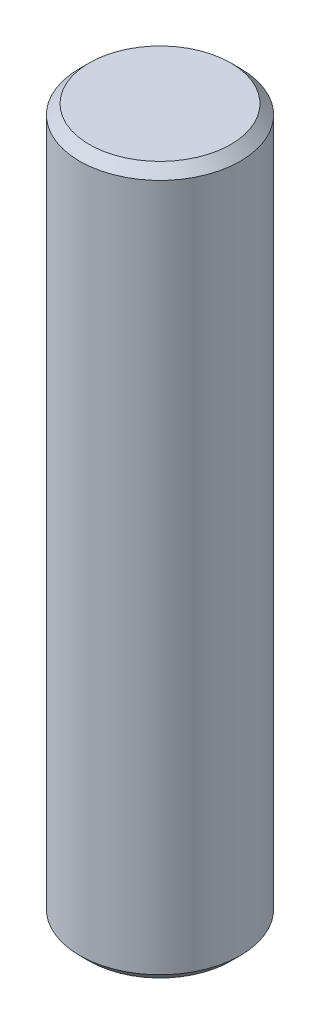
from build123d import *

# Parameters (mm, degrees)
SKETCH1_R           = 25
BOSS_EXTRUDE1_DEPTH = 220
CHAMFER1_SIZE       = 3


with BuildPart() as part:
    # Sketch1 → Boss-Extrude1 (new body)
    with BuildSketch(Plane(origin=(0, 0, 0), x_dir=(1, 0, 0), z_dir=(0, 1, 0))):
        with Locations(Location((0, 0, 0), (0, 0, 270))):
            Circle(SKETCH1_R)
    extrude(amount=-BOSS_EXTRUDE1_DEPTH)

    # Chamfer1
    chamfer1_edges = [part.edges().sort_by_distance(p)[0] for p in [
        (0, 0, -25),
        (0, -220, -25),
    ]]
    chamfer(chamfer1_edges, length=CHAMFER1_SIZE)


solid = part.part
